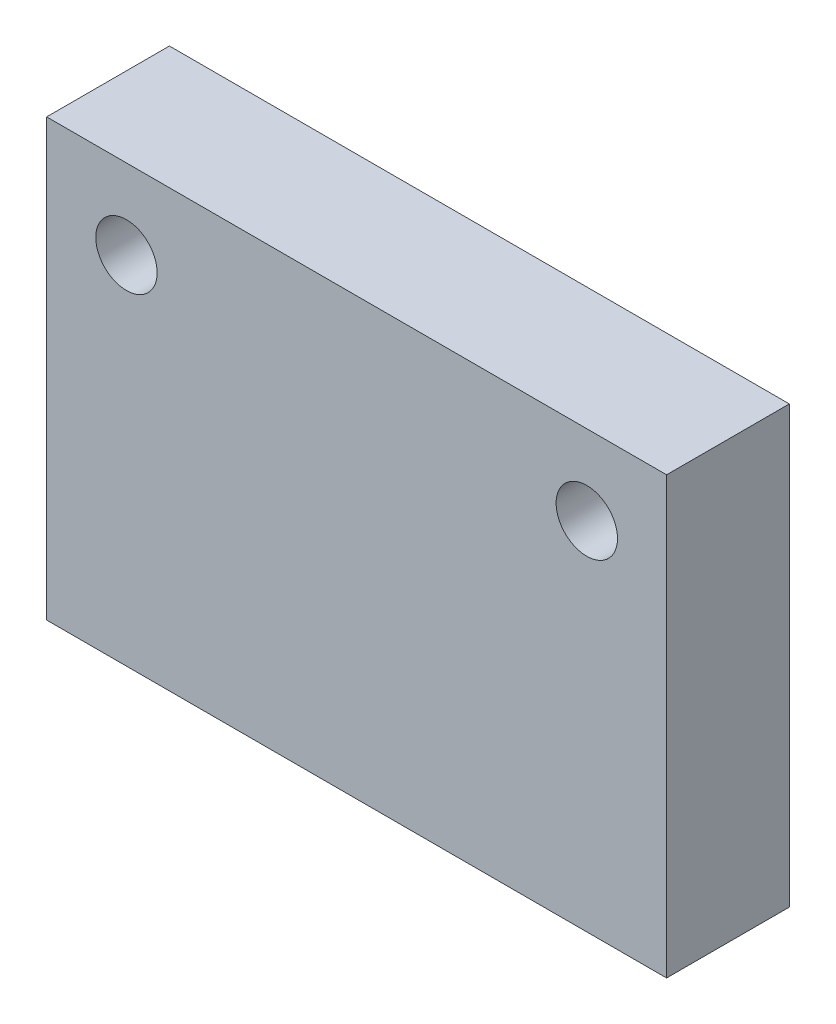
from build123d import *

# Parameters (mm, degrees)
SKETCH1_W           = 20.2
SKETCH1_H           = 20.2
SKETCH1_R           = 1
BOSS_EXTRUDE1_DEPTH = 4
SKETCH2_R           = 7
SKETCH2_R_2         = 4
CUT_EXTRUDE1_DEPTH  = 4
SKETCH3_R           = 4
BOSS_EXTRUDE2_DEPTH = 4
SKETCH4_W           = 20.2
SKETCH4_H           = 6
CUT_EXTRUDE2_DEPTH  = 10


with BuildPart() as part:
    # Sketch1 → Boss-Extrude1 (new body)
    with BuildSketch(Plane.XY):
        with Locations((0, 0.05)):
            Rectangle(SKETCH1_W, SKETCH1_H)
        with Locations((7.5, 7.55)):
            Circle(SKETCH1_R, mode=Mode.SUBTRACT)
        with Locations(Location((-7.5, 7.55, 0), (0, 0, 180))):
            Circle(SKETCH1_R, mode=Mode.SUBTRACT)
        with Locations((7.5, -8.7)):
            Circle(SKETCH1_R, mode=Mode.SUBTRACT)
        with Locations(Location((-7.5, -8.7, 0), (0, 0, 180))):
            Circle(SKETCH1_R, mode=Mode.SUBTRACT)
    extrude(amount=BOSS_EXTRUDE1_DEPTH)

    # Sketch2 → Cut-Extrude1 (cut)
    with BuildSketch(Plane.XY.offset(4)):
        with Locations((0, -13.32)):
            Circle(SKETCH2_R)
        Circle(SKETCH2_R_2)
    extrude(amount=-CUT_EXTRUDE1_DEPTH, mode=Mode.SUBTRACT)

    # Sketch3 → Boss-Extrude2 (add)
    with BuildSketch(Plane.XY.offset(4)):
        Circle(SKETCH3_R)
    extrude(amount=-BOSS_EXTRUDE2_DEPTH)

    # Sketch4 → Cut-Extrude2 (cut)
    with BuildSketch(Plane.XY.offset(4)):
        with Locations((0, -7.05)):
            Rectangle(SKETCH4_W, SKETCH4_H)
    extrude(amount=-CUT_EXTRUDE2_DEPTH, mode=Mode.SUBTRACT)


solid = part.part
